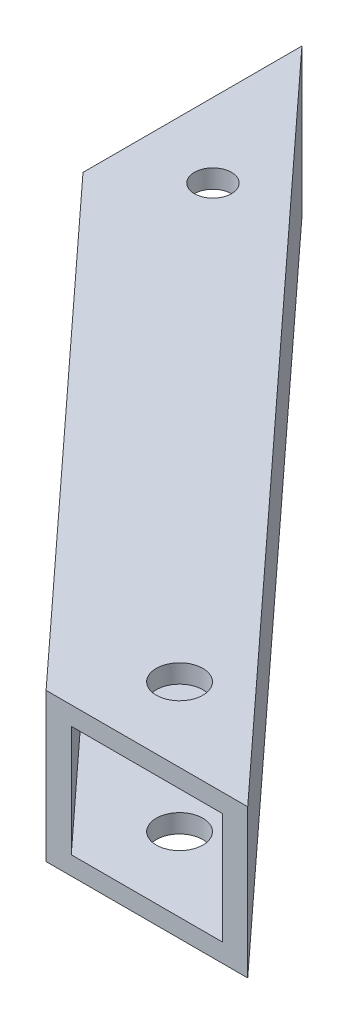
from build123d import *

# Parameters (mm, degrees)
BOSS_EXTRUDE3_DEPTH = 25.4
CUT_EXTRUDE4_REACH  = 182.233
SKETCH2_W           = 19.05
SKETCH2_H           = 19.05
CUT_EXTRUDE5_DEPTH  = 25.4
SKETCH4_R           = 3.988266949
CUT_EXTRUDE6_DEPTH  = 3.175
SKETCH5_R           = 3.175
CUT_EXTRUDE7_DEPTH  = 3.175


with BuildPart() as part:
    # Sketch1 → Boss-Extrude3 (new body)
    with BuildSketch(Plane(origin=(0, 0, 0), x_dir=(1, 0, 0), z_dir=(0, 1, 0))):
        Polygon((73.659861316, 0), (108.190600856, 0), (0, 117.475), (-18.683642708, 100.267981224), align=None)
    extrude(amount=BOSS_EXTRUDE3_DEPTH)

    # Cut-Extrude4: up to this plane
    cut_extrude4_end = Plane(origin=(0, 25.4, 0), z_dir=(0, 0, -1))
    # Sketch2 → Cut-Extrude4 (cut, up to the surface)
    with BuildSketch(Plane(origin=(-58.537665842, 0, -63.563740241), x_dir=(0.735576484560878, 0, -0.6774416841035549), z_dir=(0.6774416841035549, 0, 0.735576484560878)), mode=Mode.PRIVATE) as cut_extrude4_sk1:
        with Locations((66.880665058, 12.7)):
            Rectangle(SKETCH2_W, SKETCH2_H)
    cut_extrude4_tool1 = split(extrude(cut_extrude4_sk1.sketch, amount=CUT_EXTRUDE4_REACH, mode=Mode.PRIVATE), bisect_by=cut_extrude4_end, keep=Keep.BOTH, mode=Mode.PRIVATE)
    add(cut_extrude4_tool1.solids().sort_by_distance((-9.341821, 12.7, -108.871491))[0], mode=Mode.SUBTRACT)

    # Sketch3 → Cut-Extrude5 (cut)
    with BuildSketch(Plane(origin=(0, 25.4, 0), x_dir=(1, 0, 0), z_dir=(0, 1, 0))):
        Polygon((0, 117.475), (0, 79.980997791), (-18.683642708, 100.267981224), align=None)
        Polygon((108.190600856, 0), (73.659861316, 0), (89.250643344, -17.183967795), align=None)
    extrude(amount=-CUT_EXTRUDE5_DEPTH, mode=Mode.SUBTRACT)

    # Sketch4 → Cut-Extrude6 (cut)
    with BuildSketch(Plane(origin=(0, 25.4, 0), x_dir=(1, 0, 0), z_dir=(0, 1, 0))):
        with Locations(Location((83.819861316, 12.7, 0), (0, 0, 270))):
            Circle(SKETCH4_R)
    cut_extrude6 = extrude(amount=-CUT_EXTRUDE6_DEPTH, mode=Mode.SUBTRACT)

    # Mirror1: Cut-Extrude6 across plane
    add(cut_extrude6.mirror(Plane.ZX.offset(12.7)), mode=Mode.SUBTRACT)

    # Sketch5 → Cut-Extrude7 (cut)
    with BuildSketch(Plane.XZ):
        with Locations(Location((12.7, -89.535, 0), (0, 0, 270))):
            Circle(SKETCH5_R)
    cut_extrude7 = extrude(amount=-CUT_EXTRUDE7_DEPTH, mode=Mode.SUBTRACT)

    # Mirror2: Cut-Extrude7 across plane
    add(cut_extrude7.mirror(Plane.ZX.offset(12.7)), mode=Mode.SUBTRACT)


solid = part.part
